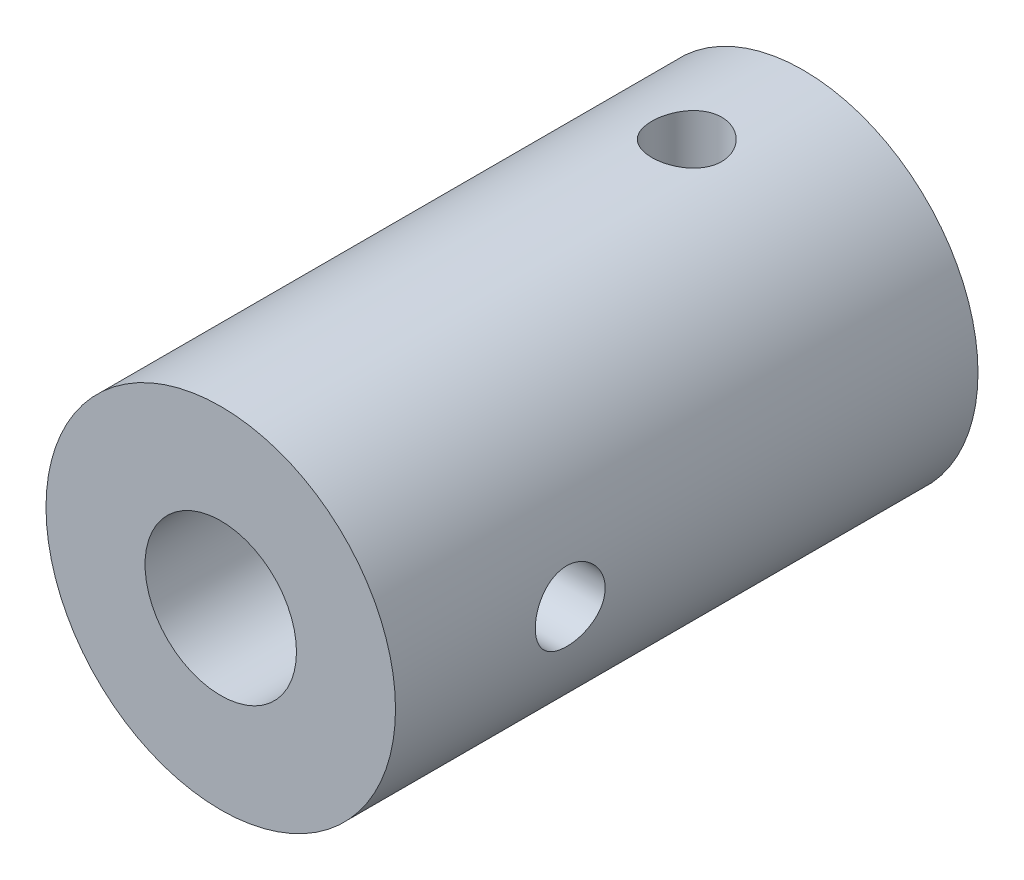
from build123d import *

# Parameters (mm, degrees)
SKETCH3_R               = 7.5
SKETCH3_R_2             = 3.25
BOSS_EXTRUDE1_DEPTH     = 12.5
CUT_EXTRUDE1_DEPTH      = 17.393596311
CUT_EXTRUDE1_DEPTH_BACK = 17.393596311
SKETCH4_R               = 1.5
CUT_EXTRUDE2_DEPTH      = 17.393596479
CUT_EXTRUDE2_DEPTH_BACK = 17.393596479
SKETCH5_R               = 1.5


with BuildPart() as part:
    # Sketch3 → Boss-Extrude1 (new, symmetric)
    with BuildSketch(Plane.XY):
        Circle(SKETCH3_R)
        Circle(SKETCH3_R_2, mode=Mode.SUBTRACT)
    extrude(amount=BOSS_EXTRUDE1_DEPTH, both=True)

    # Sketch4 → Cut-Extrude1 (cut, two sides: drawn at the far end of the back side and taken through both)
    with BuildSketch(Plane(origin=(0, 0, 0), x_dir=(0, 0, -1), z_dir=(1, 0, 0)).offset(-CUT_EXTRUDE1_DEPTH_BACK)):
        with Locations((-5, 0)):
            Circle(SKETCH4_R)
    extrude(amount=CUT_EXTRUDE1_DEPTH + CUT_EXTRUDE1_DEPTH_BACK, mode=Mode.SUBTRACT)

    # Sketch5 → Cut-Extrude2 (cut, two sides: drawn at the far end of the back side and taken through both)
    with BuildSketch(Plane(origin=(0, 0, 0), x_dir=(1, 0, 0), z_dir=(0, 1, 0)).offset(-CUT_EXTRUDE2_DEPTH_BACK)):
        with Locations(Location((0, 7.5, 0), (0, 0, 270))):
            Circle(SKETCH5_R)
    extrude(amount=CUT_EXTRUDE2_DEPTH + CUT_EXTRUDE2_DEPTH_BACK, mode=Mode.SUBTRACT)


solid = part.part
